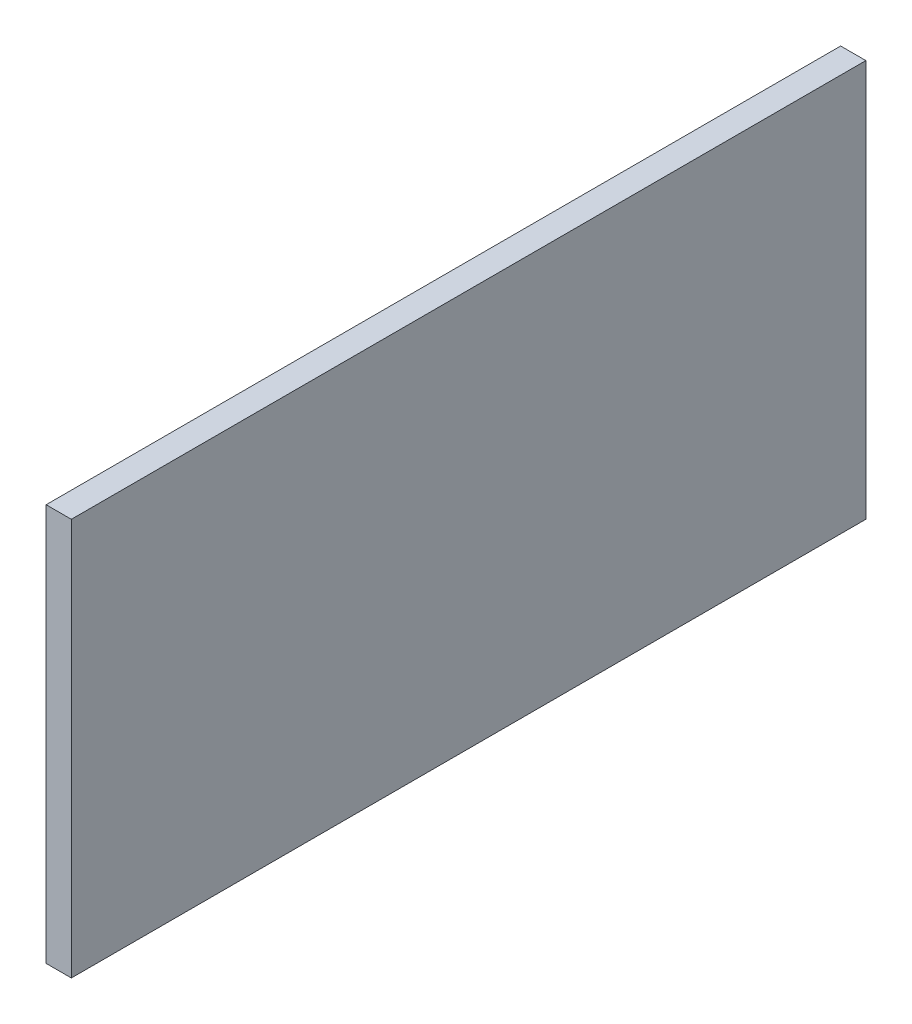
from build123d import *

# Parameters (mm, degrees)
SKETCH1_W           = 20
SKETCH1_H           = 10
BOSS_EXTRUDE1_DEPTH = 0.635


with BuildPart() as part:
    # Sketch1 → Boss-Extrude1 (new body)
    with BuildSketch(Plane(origin=(0, 0, 0), x_dir=(0, 0, -1), z_dir=(1, 0, 0))):
        Rectangle(SKETCH1_W, SKETCH1_H)
    extrude(amount=BOSS_EXTRUDE1_DEPTH)


solid = part.part
